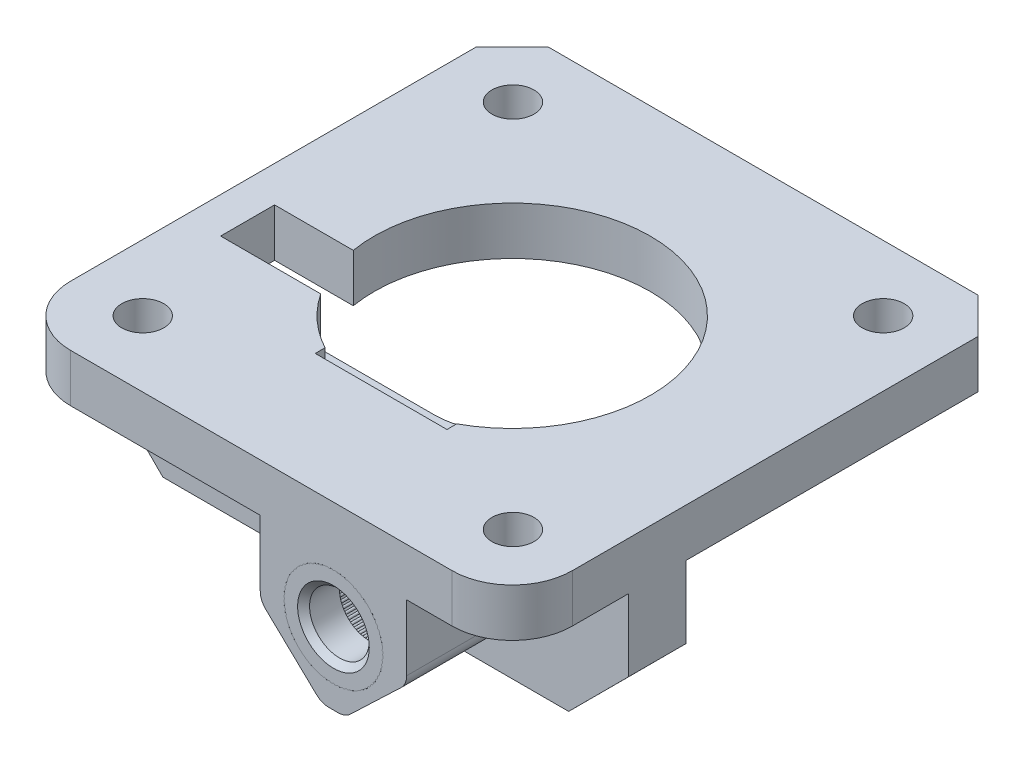
from build123d import *

# Parameters (mm, degrees)
SKETCH2_R               = 1.76
BOSS_EXTRUDE1_DEPTH     = 4.02
BOSS_EXTRUDE3_DEPTH     = 9.75
CUT_EXTRUDE2_DEPTH      = 9.75
SKETCH7_R               = 4.15
SKETCH7_R_2             = 2.5
BOSS_EXTRUDE4_DEPTH     = 3
CHAMFER1_SIZE           = 0.5
SKETCH8_W               = 4.82
SKETCH8_H               = 11.06
BOSS_EXTRUDE5_DEPTH     = 42
CUT_EXTRUDE3_DEPTH      = 41.04230388
CUT_EXTRUDE3_DEPTH_BACK = 41.04230388
CUT_EXTRUDE5_DEPTH      = 41.04230388
CUT_EXTRUDE5_DEPTH_BACK = 41.04230388
BOSS_EXTRUDE6_DEPTH     = 11.06
SKETCH12_R              = 1.405
CUT_EXTRUDE6_DEPTH      = 35.44232981
SKETCH13_R              = 2.515
BOSS_EXTRUDE7_DEPTH     = 3.02
CHAMFER2_SIZE           = 0.75
CHAMFER3_SIZE           = 1
FILLET1_R               = 0.25


with BuildPart() as part:
    # Sketch2 → Boss-Extrude1 (new body)
    with BuildSketch(Plane(origin=(0, 0, 0), x_dir=(1, 0, 0), z_dir=(0, 1, 0))):
        with BuildLine():
            Line((-21, 18.001867248), (-18.001867248, 21))
            Line((-18.001867248, 21), (18.001867248, 21))
            Line((18.001867248, 21), (21, 18.001867248))
            Line((21, 18.001867248), (21, -15.97))
            ThreePointArc((21, -15.97), (19.526747109, -19.526747109), (15.97, -21))
            Line((15.97, -21), (-15.97, -21))
            ThreePointArc((-15.97, -21), (-19.526747109, -19.526747109), (-21, -15.97))
            Line((-21, -15.97), (-21, 18.001867248))
        make_face()
        with Locations(Location((-15.47, 15.53, 0), (0, 0, 270))):
            Circle(SKETCH2_R, mode=Mode.SUBTRACT)
        with Locations(Location((15.53, 15.53, 0), (0, 0, 270))):
            Circle(SKETCH2_R, mode=Mode.SUBTRACT)
        with Locations(Location((-15.47, -15.47, 0), (0, 0, 270))):
            Circle(SKETCH2_R, mode=Mode.SUBTRACT)
        with Locations(Location((15.53, -15.47, 0), (0, 0, 270))):
            Circle(SKETCH2_R, mode=Mode.SUBTRACT)
        with BuildLine():
            Line((-5.516222822, -10.978980548), (5.516222822, -10.978980548))
            Line((5.516222822, -10.978980548), (5.516222822, -10.158980548))
            ThreePointArc((5.516222822, -10.158980548), (5.066499671, 10.390581364), (-11.401118366, -1.91))
            Line((-11.401118366, -1.91), (-17.99, -1.91))
            Line((-17.99, -1.91), (-17.99, -6.43))
            Line((-17.99, -6.43), (-9.606700786, -6.43))
            ThreePointArc((-9.606700786, -6.43), (-7.78794123, -8.542925225), (-5.516222822, -10.158980548))
            Line((-5.516222822, -10.158980548), (-5.516222822, -10.978980548))
        make_face(mode=Mode.SUBTRACT)
    extrude(amount=BOSS_EXTRUDE1_DEPTH)

    # Sketch5 → Boss-Extrude3 (add)
    with BuildSketch(Plane.XY.offset(21)):
        with BuildLine():
            Line((4.60768851, -10.642559727), (0.36768851, -6.597562817))
            ThreePointArc((0.36768851, -6.597562817), (0.021837482, -6.099229331), (-0.1, -5.50500309))
            Line((-0.1, -5.50500309), (-0.1, 0))
            Line((-0.1, 0), (12.16, 0))
            Line((12.16, 0), (12.16, -5.50500309))
            ThreePointArc((12.16, -5.50500309), (12.038162518, -6.099229331), (11.69231149, -6.597562817))
            Line((11.69231149, -6.597562817), (7.45231149, -10.642559727))
            ThreePointArc((7.45231149, -10.642559727), (6.971397725, -10.951760534), (6.41, -11.06))
            Line((6.41, -11.06), (5.65, -11.06))
            ThreePointArc((5.65, -11.06), (5.088602275, -10.951760534), (4.60768851, -10.642559727))
        make_face()
    extrude(amount=-BOSS_EXTRUDE3_DEPTH)

    # Sketch4 → Cut-Extrude2 (cut)
    with BuildSketch(Plane.XY.offset(21)):
        with BuildLine():
            ThreePointArc((6.495100704, -9.153855154), (6.571683698, -9.144496175), (6.648079471, -9.133715118))
            ThreePointArc((6.648079471, -9.133715118), (6.739998065, -9.056599117), (6.852748514, -9.097626443))
            ThreePointArc((6.852748514, -9.097626443), (6.928224398, -9.08162843), (7.003389831, -9.064230067))
            ThreePointArc((7.003389831, -9.064230067), (7.088237545, -8.979396283), (7.204134712, -9.010440639))
            ThreePointArc((7.204134712, -9.010440639), (7.277929068, -8.987925346), (7.351292107, -8.96404209))
            ThreePointArc((7.351292107, -8.96404209), (7.428423198, -8.872136159), (7.546585035, -8.892961277))
            ThreePointArc((7.546585035, -8.892961277), (7.618136244, -8.86410006), (7.689138552, -8.833913677))
            ThreePointArc((7.689138552, -8.833913677), (7.757966006, -8.735635058), (7.877493231, -8.746082448))
            ThreePointArc((7.877493231, -8.746082448), (7.946256745, -8.711094958), (8.014357951, -8.674835185))
            ThreePointArc((8.014357951, -8.674835185), (8.074357949, -8.570931837), (8.194340887, -8.570921988))
            ThreePointArc((8.194340887, -8.570921988), (8.259793375, -8.5300745), (8.324475188, -8.488017295))
            ThreePointArc((8.324475188, -8.488017295), (8.375191094, -8.379279987), (8.494716602, -8.368812973))
            ThreePointArc((8.494716602, -8.368812973), (8.55635993, -8.322416362), (8.617130083, -8.274881806))
            ThreePointArc((8.617130083, -8.274881806), (8.658175919, -8.162138094), (8.776334336, -8.141293576))
            ThreePointArc((8.776334336, -8.141293576), (8.833699362, -8.089700948), (8.890095355, -8.037050807))
            ThreePointArc((8.890095355, -8.037050807), (8.921158738, -7.921158738), (9.037050807, -7.890095355))
            ThreePointArc((9.037050807, -7.890095355), (9.089700948, -7.833699362), (9.141293576, -7.776334336))
            ThreePointArc((9.141293576, -7.776334336), (9.162138094, -7.658175919), (9.274881806, -7.617130083))
            ThreePointArc((9.274881806, -7.617130083), (9.322416362, -7.55635993), (9.368812973, -7.494716602))
            ThreePointArc((9.368812973, -7.494716602), (9.379279987, -7.375191094), (9.488017295, -7.324475188))
            ThreePointArc((9.488017295, -7.324475188), (9.5300745, -7.259793375), (9.570921988, -7.194340887))
            ThreePointArc((9.570921988, -7.194340887), (9.570931837, -7.074357949), (9.674835185, -7.014357951))
            ThreePointArc((9.674835185, -7.014357951), (9.711094958, -6.946256745), (9.746082448, -6.877493231))
            ThreePointArc((9.746082448, -6.877493231), (9.735635058, -6.757966006), (9.833913677, -6.689138552))
            ThreePointArc((9.833913677, -6.689138552), (9.86410006, -6.618136244), (9.892961277, -6.546585035))
            ThreePointArc((9.892961277, -6.546585035), (9.872136159, -6.428423198), (9.96404209, -6.351292107))
            ThreePointArc((9.96404209, -6.351292107), (9.987925346, -6.277929068), (10.010440639, -6.204134712))
            ThreePointArc((10.010440639, -6.204134712), (9.979396283, -6.088237545), (10.064230067, -6.003389831))
            ThreePointArc((10.064230067, -6.003389831), (10.08162843, -5.928224398), (10.097626443, -5.852748514))
            ThreePointArc((10.097626443, -5.852748514), (10.056599117, -5.739998065), (10.133715118, -5.648079471))
            ThreePointArc((10.133715118, -5.648079471), (10.144496175, -5.571683698), (10.153855154, -5.495100704))
            ThreePointArc((10.153855154, -5.495100704), (10.1031571, -5.386355071), (10.171968418, -5.288065153))
            ThreePointArc((10.171968418, -5.288065153), (10.17605012, -5.211020458), (10.178698838, -5.133913196))
            ThreePointArc((10.178698838, -5.133913196), (10.118715899, -5.03), (10.178698838, -4.926086804))
            ThreePointArc((10.178698838, -4.926086804), (10.17605012, -4.848979542), (10.171968418, -4.771934847))
            ThreePointArc((10.171968418, -4.771934847), (10.1031571, -4.673644929), (10.153855154, -4.564899296))
            ThreePointArc((10.153855154, -4.564899296), (10.144496175, -4.488316302), (10.133715118, -4.411920529))
            ThreePointArc((10.133715118, -4.411920529), (10.056599117, -4.320001935), (10.097626443, -4.207251486))
            ThreePointArc((10.097626443, -4.207251486), (10.08162843, -4.131775602), (10.064230067, -4.056610169))
            ThreePointArc((10.064230067, -4.056610169), (9.979396283, -3.971762455), (10.010440639, -3.855865288))
            ThreePointArc((10.010440639, -3.855865288), (9.987925346, -3.782070932), (9.96404209, -3.708707893))
            ThreePointArc((9.96404209, -3.708707893), (9.872136159, -3.631576802), (9.892961277, -3.513414965))
            ThreePointArc((9.892961277, -3.513414965), (9.86410006, -3.441863756), (9.833913677, -3.370861448))
            ThreePointArc((9.833913677, -3.370861448), (9.735635058, -3.302033994), (9.746082448, -3.182506769))
            ThreePointArc((9.746082448, -3.182506769), (9.711094958, -3.113743255), (9.674835185, -3.045642049))
            ThreePointArc((9.674835185, -3.045642049), (9.570931837, -2.985642051), (9.570921988, -2.865659113))
            ThreePointArc((9.570921988, -2.865659113), (9.5300745, -2.800206625), (9.488017295, -2.735524812))
            ThreePointArc((9.488017295, -2.735524812), (9.379279987, -2.684808906), (9.368812973, -2.565283398))
            ThreePointArc((9.368812973, -2.565283398), (9.322416362, -2.50364007), (9.274881806, -2.442869917))
            ThreePointArc((9.274881806, -2.442869917), (9.162138094, -2.401824081), (9.141293576, -2.283665664))
            ThreePointArc((9.141293576, -2.283665664), (9.089700948, -2.226300638), (9.037050807, -2.169904645))
            ThreePointArc((9.037050807, -2.169904645), (8.921158738, -2.138841262), (8.890095355, -2.022949193))
            ThreePointArc((8.890095355, -2.022949193), (8.833699362, -1.970299052), (8.776334336, -1.918706424))
            ThreePointArc((8.776334336, -1.918706424), (8.658175919, -1.897861906), (8.617130083, -1.785118194))
            ThreePointArc((8.617130083, -1.785118194), (8.55635993, -1.737583638), (8.494716602, -1.691187027))
            ThreePointArc((8.494716602, -1.691187027), (8.375191094, -1.680720013), (8.324475188, -1.571982705))
            ThreePointArc((8.324475188, -1.571982705), (8.259793375, -1.5299255), (8.194340887, -1.489078012))
            ThreePointArc((8.194340887, -1.489078012), (8.074357949, -1.489068163), (8.014357951, -1.385164815))
            ThreePointArc((8.014357951, -1.385164815), (7.946256745, -1.348905042), (7.877493231, -1.313917552))
            ThreePointArc((7.877493231, -1.313917552), (7.757966006, -1.324364942), (7.689138552, -1.226086323))
            ThreePointArc((7.689138552, -1.226086323), (7.618136244, -1.19589994), (7.546585035, -1.167038723))
            ThreePointArc((7.546585035, -1.167038723), (7.428423198, -1.187863841), (7.351292107, -1.09595791))
            ThreePointArc((7.351292107, -1.09595791), (7.277929068, -1.072074654), (7.204134712, -1.049559361))
            ThreePointArc((7.204134712, -1.049559361), (7.088237545, -1.080603717), (7.003389831, -0.995769933))
            ThreePointArc((7.003389831, -0.995769933), (6.928224398, -0.97837157), (6.852748514, -0.962373557))
            ThreePointArc((6.852748514, -0.962373557), (6.739998065, -1.003400883), (6.648079471, -0.926284882))
            ThreePointArc((6.648079471, -0.926284882), (6.571683698, -0.915503825), (6.495100704, -0.906144846))
            ThreePointArc((6.495100704, -0.906144846), (6.386355071, -0.9568429), (6.288065153, -0.888031582))
            ThreePointArc((6.288065153, -0.888031582), (6.211020458, -0.88394988), (6.133913196, -0.881301162))
            ThreePointArc((6.133913196, -0.881301162), (6.03, -0.941284101), (5.926086804, -0.881301162))
            ThreePointArc((5.926086804, -0.881301162), (5.848979542, -0.88394988), (5.771934847, -0.888031582))
            ThreePointArc((5.771934847, -0.888031582), (5.673644929, -0.9568429), (5.564899296, -0.906144846))
            ThreePointArc((5.564899296, -0.906144846), (5.488316302, -0.915503825), (5.411920529, -0.926284882))
            ThreePointArc((5.411920529, -0.926284882), (5.320001935, -1.003400883), (5.207251486, -0.962373557))
            ThreePointArc((5.207251486, -0.962373557), (5.131775602, -0.97837157), (5.056610169, -0.995769933))
            ThreePointArc((5.056610169, -0.995769933), (4.971762455, -1.080603717), (4.855865288, -1.049559361))
            ThreePointArc((4.855865288, -1.049559361), (4.782070932, -1.072074654), (4.708707893, -1.09595791))
            ThreePointArc((4.708707893, -1.09595791), (4.631576802, -1.187863841), (4.513414965, -1.167038723))
            ThreePointArc((4.513414965, -1.167038723), (4.441863756, -1.19589994), (4.370861448, -1.226086323))
            ThreePointArc((4.370861448, -1.226086323), (4.302033994, -1.324364942), (4.182506769, -1.313917552))
            ThreePointArc((4.182506769, -1.313917552), (4.113743255, -1.348905042), (4.045642049, -1.385164815))
            ThreePointArc((4.045642049, -1.385164815), (3.985642051, -1.489068163), (3.865659113, -1.489078012))
            ThreePointArc((3.865659113, -1.489078012), (3.800206625, -1.5299255), (3.735524812, -1.571982705))
            ThreePointArc((3.735524812, -1.571982705), (3.684808906, -1.680720013), (3.565283398, -1.691187027))
            ThreePointArc((3.565283398, -1.691187027), (3.50364007, -1.737583638), (3.442869917, -1.785118194))
            ThreePointArc((3.442869917, -1.785118194), (3.401824081, -1.897861906), (3.283665664, -1.918706424))
            ThreePointArc((3.283665664, -1.918706424), (3.226300638, -1.970299052), (3.169904645, -2.022949193))
            ThreePointArc((3.169904645, -2.022949193), (3.138841262, -2.138841262), (3.022949193, -2.169904645))
            ThreePointArc((3.022949193, -2.169904645), (2.970299052, -2.226300638), (2.918706424, -2.283665664))
            ThreePointArc((2.918706424, -2.283665664), (2.897861906, -2.401824081), (2.785118194, -2.442869917))
            ThreePointArc((2.785118194, -2.442869917), (2.737583638, -2.50364007), (2.691187027, -2.565283398))
            ThreePointArc((2.691187027, -2.565283398), (2.680720013, -2.684808906), (2.571982705, -2.735524812))
            ThreePointArc((2.571982705, -2.735524812), (2.5299255, -2.800206625), (2.489078012, -2.865659113))
            ThreePointArc((2.489078012, -2.865659113), (2.489068163, -2.985642051), (2.385164815, -3.045642049))
            ThreePointArc((2.385164815, -3.045642049), (2.348905042, -3.113743255), (2.313917552, -3.182506769))
            ThreePointArc((2.313917552, -3.182506769), (2.324364942, -3.302033994), (2.226086323, -3.370861448))
            ThreePointArc((2.226086323, -3.370861448), (2.19589994, -3.441863756), (2.167038723, -3.513414965))
            ThreePointArc((2.167038723, -3.513414965), (2.187863841, -3.631576802), (2.09595791, -3.708707893))
            ThreePointArc((2.09595791, -3.708707893), (2.072074654, -3.782070932), (2.049559361, -3.855865288))
            ThreePointArc((2.049559361, -3.855865288), (2.080603717, -3.971762455), (1.995769933, -4.056610169))
            ThreePointArc((1.995769933, -4.056610169), (1.97837157, -4.131775602), (1.962373557, -4.207251486))
            ThreePointArc((1.962373557, -4.207251486), (2.003400883, -4.320001935), (1.926284882, -4.411920529))
            ThreePointArc((1.926284882, -4.411920529), (1.915503825, -4.488316302), (1.906144846, -4.564899296))
            ThreePointArc((1.906144846, -4.564899296), (1.9568429, -4.673644929), (1.888031582, -4.771934847))
            ThreePointArc((1.888031582, -4.771934847), (1.88394988, -4.848979542), (1.881301162, -4.926086804))
            ThreePointArc((1.881301162, -4.926086804), (1.941284101, -5.03), (1.881301162, -5.133913196))
            ThreePointArc((1.881301162, -5.133913196), (1.88394988, -5.211020458), (1.888031582, -5.288065153))
            ThreePointArc((1.888031582, -5.288065153), (1.9568429, -5.386355071), (1.906144846, -5.495100704))
            ThreePointArc((1.906144846, -5.495100704), (1.915503825, -5.571683698), (1.926284882, -5.648079471))
            ThreePointArc((1.926284882, -5.648079471), (2.003400883, -5.739998065), (1.962373557, -5.852748514))
            ThreePointArc((1.962373557, -5.852748514), (1.97837157, -5.928224398), (1.995769933, -6.003389831))
            ThreePointArc((1.995769933, -6.003389831), (2.080603717, -6.088237545), (2.049559361, -6.204134712))
            ThreePointArc((2.049559361, -6.204134712), (2.072074654, -6.277929068), (2.09595791, -6.351292107))
            ThreePointArc((2.09595791, -6.351292107), (2.187863841, -6.428423198), (2.167038723, -6.546585035))
            ThreePointArc((2.167038723, -6.546585035), (2.19589994, -6.618136244), (2.226086323, -6.689138552))
            ThreePointArc((2.226086323, -6.689138552), (2.324364942, -6.757966006), (2.313917552, -6.877493231))
            ThreePointArc((2.313917552, -6.877493231), (2.348905042, -6.946256745), (2.385164815, -7.014357951))
            ThreePointArc((2.385164815, -7.014357951), (2.489068163, -7.074357949), (2.489078012, -7.194340887))
            ThreePointArc((2.489078012, -7.194340887), (2.5299255, -7.259793375), (2.571982705, -7.324475188))
            ThreePointArc((2.571982705, -7.324475188), (2.680720013, -7.375191094), (2.691187027, -7.494716602))
            ThreePointArc((2.691187027, -7.494716602), (2.737583638, -7.55635993), (2.785118194, -7.617130083))
            ThreePointArc((2.785118194, -7.617130083), (2.897861906, -7.658175919), (2.918706424, -7.776334336))
            ThreePointArc((2.918706424, -7.776334336), (2.970299052, -7.833699362), (3.022949193, -7.890095355))
            ThreePointArc((3.022949193, -7.890095355), (3.138841262, -7.921158738), (3.169904645, -8.037050807))
            ThreePointArc((3.169904645, -8.037050807), (3.226300638, -8.089700948), (3.283665664, -8.141293576))
            ThreePointArc((3.283665664, -8.141293576), (3.401824081, -8.162138094), (3.442869917, -8.274881806))
            ThreePointArc((3.442869917, -8.274881806), (3.50364007, -8.322416362), (3.565283398, -8.368812973))
            ThreePointArc((3.565283398, -8.368812973), (3.684808906, -8.379279987), (3.735524812, -8.488017295))
            ThreePointArc((3.735524812, -8.488017295), (3.800206625, -8.5300745), (3.865659113, -8.570921988))
            ThreePointArc((3.865659113, -8.570921988), (3.985642051, -8.570931837), (4.045642049, -8.674835185))
            ThreePointArc((4.045642049, -8.674835185), (4.113743255, -8.711094958), (4.182506769, -8.746082448))
            ThreePointArc((4.182506769, -8.746082448), (4.302033994, -8.735635058), (4.370861448, -8.833913677))
            ThreePointArc((4.370861448, -8.833913677), (4.441863756, -8.86410006), (4.513414965, -8.892961277))
            ThreePointArc((4.513414965, -8.892961277), (4.631576802, -8.872136159), (4.708707893, -8.96404209))
            ThreePointArc((4.708707893, -8.96404209), (4.782070932, -8.987925346), (4.855865288, -9.010440639))
            ThreePointArc((4.855865288, -9.010440639), (4.971762455, -8.979396283), (5.056610169, -9.064230067))
            ThreePointArc((5.056610169, -9.064230067), (5.131775602, -9.08162843), (5.207251486, -9.097626443))
            ThreePointArc((5.207251486, -9.097626443), (5.320001935, -9.056599117), (5.411920529, -9.133715118))
            ThreePointArc((5.411920529, -9.133715118), (5.488316302, -9.144496175), (5.564899296, -9.153855154))
            ThreePointArc((5.564899296, -9.153855154), (5.673644929, -9.1031571), (5.771934847, -9.171968418))
            ThreePointArc((5.771934847, -9.171968418), (5.848979542, -9.17605012), (5.926086804, -9.178698838))
            ThreePointArc((5.926086804, -9.178698838), (6.03, -9.118715899), (6.133913196, -9.178698838))
            ThreePointArc((6.133913196, -9.178698838), (6.211020458, -9.17605012), (6.288065153, -9.171968418))
            ThreePointArc((6.288065153, -9.171968418), (6.386355071, -9.1031571), (6.495100704, -9.153855154))
        make_face()
    extrude(amount=-CUT_EXTRUDE2_DEPTH, mode=Mode.SUBTRACT)

    # Sketch8 → Boss-Extrude5 (add)
    with BuildSketch(Plane(origin=(21, 0, 0), x_dir=(0, 0, -1), z_dir=(1, 0, 0))):
        with Locations((-8.84, -5.53)):
            Rectangle(SKETCH8_W, SKETCH8_H)
    extrude(amount=-BOSS_EXTRUDE5_DEPTH)

    # Sketch9 → Cut-Extrude3 (cut, two sides: drawn at the far end of the back side and taken through both)
    with BuildSketch(Plane.XY.offset(11.25).offset(-CUT_EXTRUDE3_DEPTH_BACK)):
        Polygon((89.11132835, 62.148324552), (21, -6.03), (15.974942786, -11.06), (-52.136385564, -79.238324552), (84.22026354, -215.460981252), (225.467977454, -74.074332148), align=None)
    extrude(amount=CUT_EXTRUDE3_DEPTH + CUT_EXTRUDE3_DEPTH_BACK, mode=Mode.SUBTRACT)

    # Sketch10 → Cut-Extrude5 (cut, two sides: drawn at the far end of the back side and taken through both)
    with BuildSketch(Plane.XY.offset(11.25).offset(-CUT_EXTRUDE5_DEPTH_BACK)):
        Polygon((-89.833102575, 60.858921776), (-21, -8.06), (-18.003735659, -11.06), (50.829366916, -79.978921776), (-87.008476637, -217.645126926), (-227.670946127, -76.807283374), align=None)
    extrude(amount=CUT_EXTRUDE5_DEPTH + CUT_EXTRUDE5_DEPTH_BACK, mode=Mode.SUBTRACT)

    # Sketch11 → Boss-Extrude6 (add)
    with BuildSketch(Plane.XZ):
        with BuildLine():
            Line((4.471649607, 3.958975995), (7.661649607, 3.958975995))
            ThreePointArc((7.661649607, 3.958975995), (9.59382016, 5.771575861), (12.16, 6.43))
            Line((12.16, 6.43), (-0.026700786, 6.43))
            ThreePointArc((-0.026700786, 6.43), (2.539479054, 5.771575861), (4.471649607, 3.958975995))
        make_face()
    extrude(amount=BOSS_EXTRUDE6_DEPTH)

    # Sketch12 → Cut-Extrude6 (cut, through all)
    with BuildSketch(Plane(origin=(0, 0, 3.958975995), x_dir=(-1, 0, 0), z_dir=(0, 0, -1))):
        with Locations((-6.066649607, -5.03)):
            Circle(SKETCH12_R)
    extrude(amount=-CUT_EXTRUDE6_DEPTH, mode=Mode.SUBTRACT)

    # Sketch13 → Boss-Extrude7 (add)
    with BuildSketch(Plane(origin=(0, 0, 6.43), x_dir=(-1, 0, 0), z_dir=(0, 0, -1))):
        with Locations(Location((14.88, -5.53, 0), (0, 0, 180))):
            Circle(SKETCH13_R)
    extrude(amount=BOSS_EXTRUDE7_DEPTH)

    # Chamfer2
    chamfer2_edges = [part.edges().sort_by_distance(p)[0] for p in [
        (-17.395, -5.53, 3.41),
    ]]
    chamfer(chamfer2_edges, length=CHAMFER2_SIZE)

    # Chamfer3
    chamfer3_edges = [part.edges().sort_by_distance(p)[0] for p in [
        (-15.47, 0, -17.29),
    ]]
    chamfer(chamfer3_edges, length=CHAMFER3_SIZE)

    # Fillet1
    fillet1_edges = [part.edges().sort_by_distance(p)[0] for p in [
        (4.471649607, -5.53, 3.958975995),
        (7.661649607, -5.53, 3.958975995),
    ]]
    fillet(fillet1_edges, radius=FILLET1_R)


with BuildPart() as body_2:
    # Sketch7 → Boss-Extrude4 (new body)
    with BuildSketch(Plane.XY.offset(21)):
        with Locations((6.03, -5.03)):
            Circle(SKETCH7_R)
        with Locations((6.03, -5.03)):
            Circle(SKETCH7_R_2, mode=Mode.SUBTRACT)
    extrude(amount=-BOSS_EXTRUDE4_DEPTH)

    # Chamfer1
    chamfer1_edges = [body_2.edges().sort_by_distance(p)[0] for p in [
        (3.53, -5.03, 21),
    ]]
    chamfer(chamfer1_edges, length=CHAMFER1_SIZE)


solid = Compound([part.part, body_2.part])
